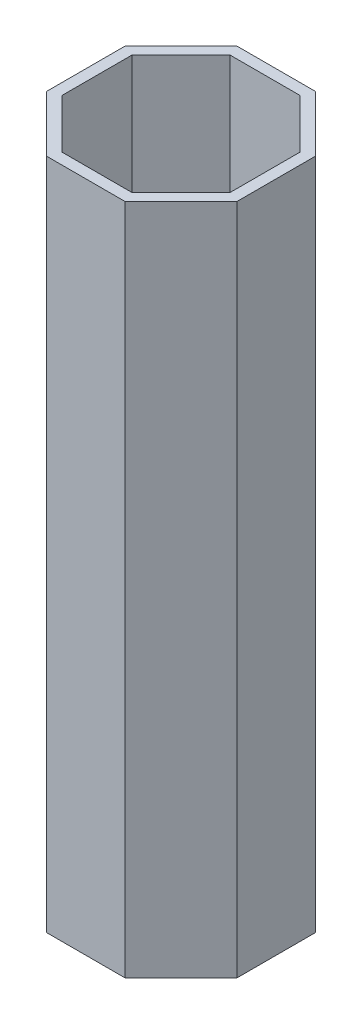
from build123d import *

# Parameters (mm, degrees)
CROQUIS1_R              = 1.55
CROQUIS1_R_2            = 4
SALIENTE_EXTRUIR1_DEPTH = 120
CORTAR_EXTRUIR1_DEPTH   = 117


with BuildPart() as part:
    # Croquis1 → Saliente-Extruir1 (new body)
    with BuildSketch(Plane(origin=(0, 0, 0), x_dir=(1, 0, 0), z_dir=(0, 1, 0))):
        Polygon((17, -7.04163056), (17, 7.04163056), (7.04163056, 17), (-7.04163056, 17), (-17, 7.04163056), (-17, -7.04163056), (-7.04163056, -17), (7.04163056, -17), align=None)
        with Locations(Location((0, 11, 0), (0, 0, 270))):
            Circle(CROQUIS1_R, mode=Mode.SUBTRACT)
        with Locations(Location((0, 0, 0), (0, 0, 270))):
            Circle(CROQUIS1_R_2, mode=Mode.SUBTRACT)
        with Locations(Location((7.778174593, 7.778174593, 0), (0, 0, 270))):
            Circle(CROQUIS1_R, mode=Mode.SUBTRACT)
        with Locations(Location((11, 0, 0), (0, 0, 270))):
            Circle(CROQUIS1_R, mode=Mode.SUBTRACT)
        with Locations(Location((7.778174593, -7.778174593, 0), (0, 0, 270))):
            Circle(CROQUIS1_R, mode=Mode.SUBTRACT)
        with Locations(Location((0, -11, 0), (0, 0, 270))):
            Circle(CROQUIS1_R, mode=Mode.SUBTRACT)
        with Locations(Location((-7.778174593, -7.778174593, 0), (0, 0, 270))):
            Circle(CROQUIS1_R, mode=Mode.SUBTRACT)
        with Locations(Location((-11, 0, 0), (0, 0, 270))):
            Circle(CROQUIS1_R, mode=Mode.SUBTRACT)
        with Locations(Location((-7.778174593, 7.778174593, 0), (0, 0, 270))):
            Circle(CROQUIS1_R, mode=Mode.SUBTRACT)
    extrude(amount=SALIENTE_EXTRUIR1_DEPTH)

    # Croquis2 → Cortar-Extruir1 (cut)
    with BuildSketch(Plane(origin=(0, 120, 0), x_dir=(1, 0, 0), z_dir=(0, 1, 0))):
        Polygon((6.213203436, 15), (-6.213203436, 15), (-15, 6.213203436), (-15, -6.213203436), (-6.213203436, -15), (6.213203436, -15), (15, -6.213203436), (15, 6.213203436), align=None)
    extrude(amount=-CORTAR_EXTRUIR1_DEPTH, mode=Mode.SUBTRACT)


solid = part.part
